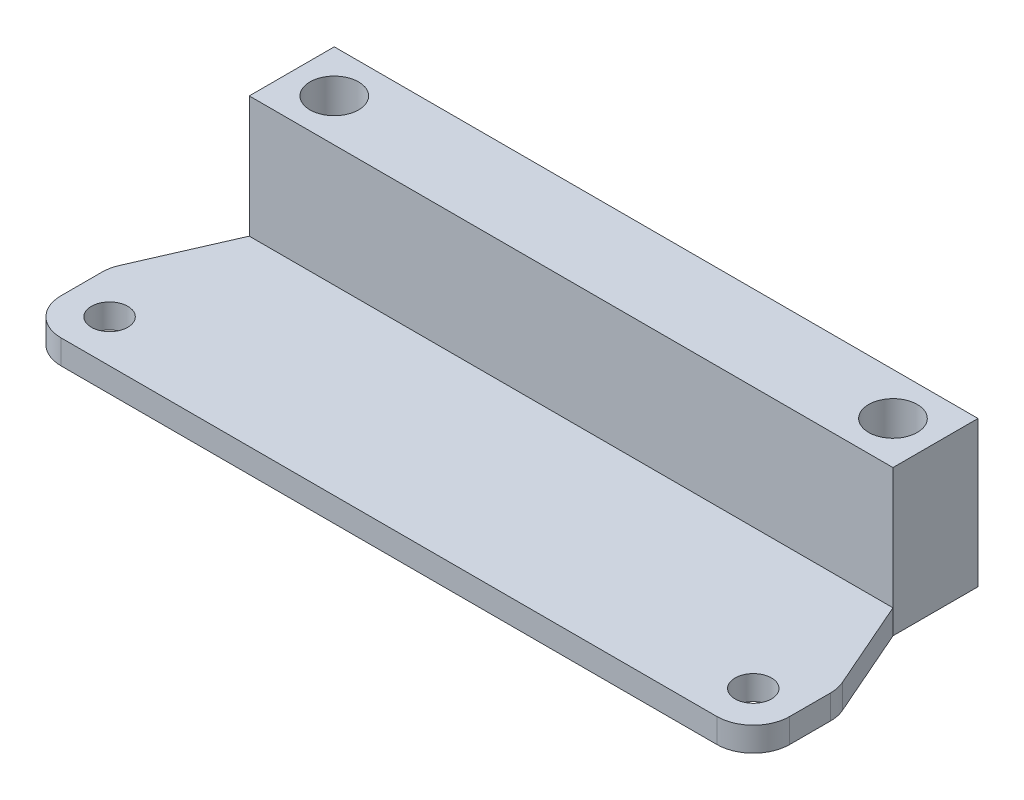
from build123d import *

# Parameters (mm, degrees)
SKETCH1_W           = 53
SKETCH1_H           = 7
BOSS_EXTRUDE1_DEPTH = 2
SKETCH2_R           = 1.5
CUT_EXTRUDE1_DEPTH  = 2
SKETCH3_W           = 53
SKETCH3_H           = 7
BOSS_EXTRUDE2_DEPTH = 10
SKETCH4_R           = 2
CUT_EXTRUDE2_DEPTH  = 3.5


with BuildPart() as part:
    # Sketch1 → Boss-Extrude1 (new body)
    with BuildSketch(Plane(origin=(0, 0, 0), x_dir=(1, 0, 0), z_dir=(0, 1, 0))):
        with BuildLine():
            Line((3.5, 15), (0.251527995, 7.574921132))
            ThreePointArc((0.251527995, 7.574921132), (0.144442027, 7.29213232), (0.066367549, 7))
            Line((0.066367549, 7), (59.933632451, 7))
            ThreePointArc((59.933632451, 7), (59.855557973, 7.29213232), (59.748472005, 7.574921132))
            Line((59.748472005, 7.574921132), (56.5, 15))
            Line((56.5, 15), (3.5, 15))
        make_face()
        with Locations((30, 18.5)):
            Rectangle(SKETCH1_W, SKETCH1_H)
        with BuildLine():
            Line((59.933632451, 7), (0.066367549, 7))
            ThreePointArc((0.066367549, 7), (0.016638024, 6.687982178), (0, 6.37246463))
            Line((0, 6.37246463), (0, 3))
            ThreePointArc((0, 3), (0.878679656, 0.878679656), (3, 0))
            Line((3, 0), (57, 0))
            ThreePointArc((57, 0), (59.121320344, 0.878679656), (60, 3))
            Line((60, 3), (60, 6.37246463))
            ThreePointArc((60, 6.37246463), (59.983361976, 6.687982178), (59.933632451, 7))
        make_face()
    extrude(amount=BOSS_EXTRUDE1_DEPTH)

    # Sketch2 → Cut-Extrude1 (cut)
    with BuildSketch(Plane(origin=(0, 2, 0), x_dir=(1, 0, 0), z_dir=(0, 1, 0))):
        with Locations(Location((3.5, 3.5, 0), (0, 0, 270))):
            Circle(SKETCH2_R)
        with Locations(Location((56.5, 3.5, 0), (0, 0, 270))):
            Circle(SKETCH2_R)
    extrude(amount=-CUT_EXTRUDE1_DEPTH, mode=Mode.SUBTRACT)

    # Sketch3 → Boss-Extrude2 (add)
    with BuildSketch(Plane(origin=(0, 2, 0), x_dir=(1, 0, 0), z_dir=(0, 1, 0))):
        with Locations((30, 18.5)):
            Rectangle(SKETCH3_W, SKETCH3_H)
    extrude(amount=BOSS_EXTRUDE2_DEPTH)

    # Sketch4 → Cut-Extrude2 (cut)
    with BuildSketch(Plane(origin=(0, 12, 0), x_dir=(1, 0, 0), z_dir=(0, 1, 0))):
        with Locations(Location((7, 18.5, 0), (0, 0, 270))):
            Circle(SKETCH4_R)
        with Locations(Location((53, 18.5, 0), (0, 0, 270))):
            Circle(SKETCH4_R)
    extrude(amount=-CUT_EXTRUDE2_DEPTH, mode=Mode.SUBTRACT)


solid = part.part
